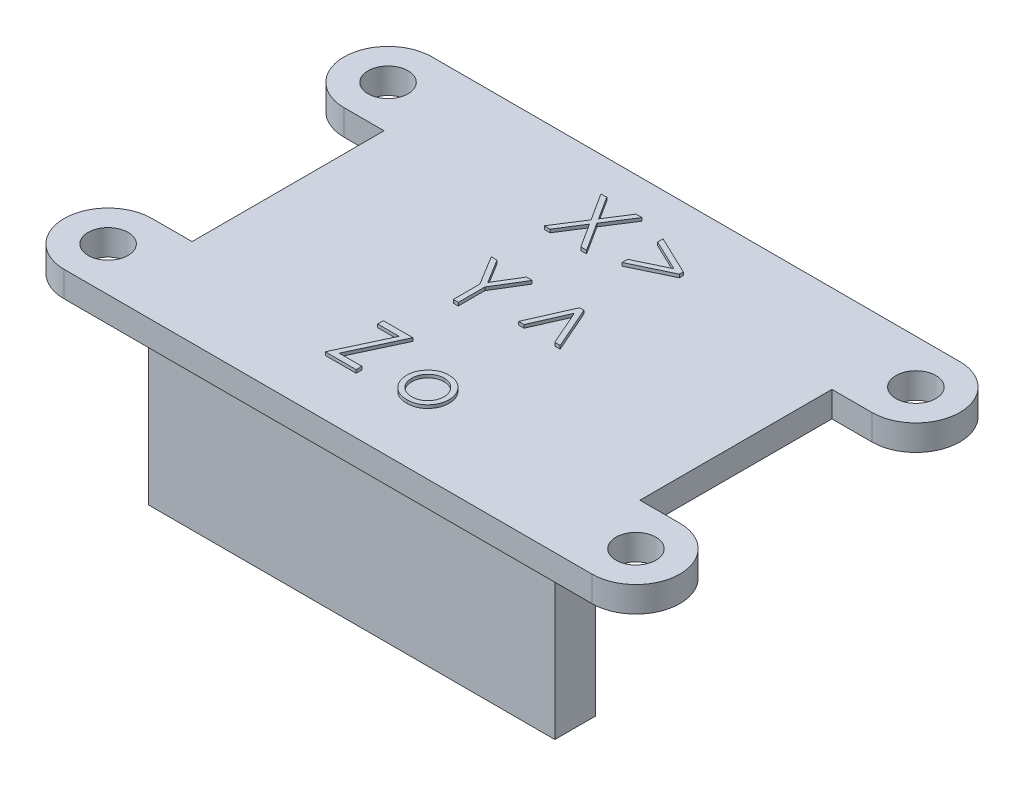
from build123d import *

# Parameters (mm, degrees)
BOSS_EXTRUDE1_DEPTH = 1.6
SKETCH2_R           = 1.25
CUT_EXTRUDE1_DEPTH  = 23.480491543
SKETCH3_W           = 25.4
SKETCH3_H           = 2.54
BOSS_EXTRUDE2_DEPTH = 10
BOSS_EXTRUDE3_DEPTH = 0.2


with BuildPart() as part:
    # Sketch1 → Boss-Extrude1 (new body)
    with BuildSketch(Plane(origin=(0, 0, 0), x_dir=(1, 0, 0), z_dir=(0, 1, 0))):
        with BuildLine():
            Line((-14, 11.5), (-16.5, 11.5))
            ThreePointArc((-16.5, 11.5), (-19.25, 8.75), (-16.5, 6))
            Line((-16.5, 6), (-14, 6))
            Line((-14, 6), (-14, -6))
            Line((-14, -6), (-16.5, -6))
            ThreePointArc((-16.5, -6), (-19.25, -8.75), (-16.5, -11.5))
            Line((-16.5, -11.5), (-14, -11.5))
            Line((-14, -11.5), (14, -11.5))
            Line((14, -11.5), (16.5, -11.5))
            ThreePointArc((16.5, -11.5), (19.25, -8.75), (16.5, -6))
            Line((16.5, -6), (14, -6))
            Line((14, -6), (14, 6))
            Line((14, 6), (16.5, 6))
            ThreePointArc((16.5, 6), (19.25, 8.75), (16.5, 11.5))
            Line((16.5, 11.5), (14, 11.5))
            Line((14, 11.5), (-14, 11.5))
        make_face()
    extrude(amount=BOSS_EXTRUDE1_DEPTH)

    # Sketch2 → Cut-Extrude1 (cut, through all)
    with BuildSketch(Plane(origin=(0, 1.6, 0), x_dir=(1, 0, 0), z_dir=(0, 1, 0))):
        with Locations(Location((-16.5, 8.75, 0), (0, 0, 270))):
            Circle(SKETCH2_R)
        with Locations(Location((16.5, 8.75, 0), (0, 0, 270))):
            Circle(SKETCH2_R)
        with Locations(Location((16.5, -8.75, 0), (0, 0, 270))):
            Circle(SKETCH2_R)
        with Locations(Location((-16.5, -8.75, 0), (0, 0, 270))):
            Circle(SKETCH2_R)
    extrude(amount=-CUT_EXTRUDE1_DEPTH, mode=Mode.SUBTRACT)

    # Sketch3 → Boss-Extrude2 (add)
    with BuildSketch(Plane.XZ):
        with Locations((0, 8.75)):
            Rectangle(SKETCH3_W, SKETCH3_H)
    extrude(amount=BOSS_EXTRUDE2_DEPTH)

    # Sketch4 → Boss-Extrude3 (add)
    # profile 1 of 6: a face of its own
    with BuildSketch(Plane(origin=(0, 1.6, 0), x_dir=(1, 0, 0), z_dir=(0, 1, 0))):
        Polygon((-3.603530873, 9.165262271), (-3.241050905, 9.165262271), (-2.324684719, 7.733571566), (-1.408318533, 9.165262271), (-1.045838565, 9.165262271), (-2.143094174, 7.450318361), (-1.00096677, 5.665262271), (-1.363446738, 5.665262271), (-2.324684719, 7.167065156), (-3.2859227, 5.665262271), (-3.648402668, 5.665262271), (-2.505574142, 7.450318361), align=None)
    # profile 2 of 6: a face of its own
    with BuildSketch(Plane(origin=(0, 1.6, 0), x_dir=(1, 0, 0), z_dir=(0, 1, 0))):
        Polygon((0.771469127, 6.455426534), (2.736012396, 7.392826374), (0.771469127, 8.330226214), (0.771469127, 8.671672528), (3.19454605, 7.515522688), (3.19454605, 7.27013006), (0.771469127, 6.11398022), align=None)
    # profile 3 of 6: a face of its own
    with BuildSketch(Plane(origin=(0, 1.6, 0), x_dir=(1, 0, 0), z_dir=(0, 1, 0))):
        Polygon((-3.62596677, 2.331928938), (-3.26629129, 2.331928938), (-2.346419495, 0.828022688), (-1.427949944, 2.331928938), (-1.068274463, 2.331928938), (-2.190069335, 0.495690957), (-2.190069335, -1.168071062), (-2.504171899, -1.168071062), (-2.504171899, 0.495690957), align=None)
    # profile 4 of 6: a face of its own
    with BuildSketch(Plane(origin=(0, 1.6, 0), x_dir=(1, 0, 0), z_dir=(0, 1, 0))):
        Polygon((1.893263999, 2.331928938), (2.162494768, 2.331928938), (3.329161435, -0.315506959), (2.990519608, -0.315506959), (2.027879383, 1.868487432), (1.065239159, -0.315506959), (0.726597332, -0.315506959), align=None)
    # profile 5 of 6: a face of its own
    with BuildSketch(Plane(origin=(0, 1.6, 0), x_dir=(1, 0, 0), z_dir=(0, 1, 0))):
        Polygon((-3.536223181, -4.860378754), (-3.536223181, -4.501404395), (-1.696479591, -4.501404395), (-3.164628629, -7.642430036), (-1.741351386, -7.642430036), (-1.741351386, -8.001404395), (-3.670838565, -8.001404395), (-2.202689527, -4.860378754), align=None)
    # profile 6 of 6: a face of its own
    with BuildSketch(Plane(origin=(0, 1.6, 0), x_dir=(1, 0, 0), z_dir=(0, 1, 0))):
        with BuildLine():
            add(Edge.make_bspline(
                [(1.468384191, -5.398840293), (1.516375464, -5.399862184), (1.610474622, -5.401865863), (1.748282507, -5.423280828), (1.879827643, -5.456028193), (2.005613835, -5.501299755), (2.124030131, -5.561981705), (2.236801375, -5.634390996), (2.343618384, -5.72017359), (2.407641413, -5.786531658), (2.440138999, -5.820214492)],
                knots=[0, 0, 0, 0, 1.054011418, 2.066658804, 3.057071809, 4.030435133, 4.997543892, 5.974964718, 6.972108034, 8, 8, 8, 8], degree=3))
            add(Edge.make_bspline(
                [(2.440138999, -5.820214492), (2.468120953, -5.852428477), (2.523543333, -5.91623302), (2.594609052, -6.019688632), (2.655830612, -6.126828733), (2.704893573, -6.23907606), (2.743578597, -6.355450731), (2.771044293, -6.476352742), (2.787381228, -6.601515089), (2.789584195, -6.686518927), (2.790699896, -6.729569459)],
                knots=[0, 0, 0, 0, 1.025258237, 2.030674902, 3.01204498, 3.988269485, 4.97094183, 5.956517959, 6.965070386, 8, 8, 8, 8], degree=3))
            add(Edge.make_bspline(
                [(2.790699896, -6.729569459), (2.789718559, -6.772869517), (2.787779391, -6.85843245), (2.769435774, -6.984451816), (2.740904688, -7.106646639), (2.70007285, -7.224505333), (2.647714741, -7.33838816), (2.583824053, -7.447797709), (2.507952436, -7.552949843), (2.421948439, -7.652951681), (2.326896563, -7.745117896), (2.223780415, -7.825446165), (2.114626381, -7.89426769), (1.997983028, -7.949704105), (1.874915541, -7.993413806), (1.745158473, -8.024113822), (1.608913403, -8.042675506), (1.515886181, -8.045059079), (1.468384191, -8.04627619)],
                knots=[0, 0, 0, 0, 0.998656419, 1.973391657, 2.932242238, 3.890759089, 4.846373663, 5.82037756, 6.809684879, 7.83454468, 8.860553229, 9.859544525, 10.845671541, 11.83227036, 12.833544569, 13.85385346, 14.904124723, 16, 16, 16, 16], degree=3))
            add(Edge.make_bspline(
                [(1.468384191, -8.04627619), (1.420649472, -8.045054994), (1.327158612, -8.04266322), (1.19043263, -8.024185937), (1.060443011, -7.993427954), (0.937214412, -7.949560461), (0.820069566, -7.894265918), (0.710283069, -7.825654228), (0.607083153, -7.745094073), (0.512011169, -7.652958136), (0.426012563, -7.55294818), (0.350139555, -7.447798141), (0.286249229, -7.338388048), (0.233891025, -7.224505363), (0.193059212, -7.106646631), (0.164528119, -6.984451818), (0.146184505, -6.85843245), (0.144245336, -6.772869517), (0.143263999, -6.729569459)],
                knots=[0, 0, 0, 0, 1.099876186, 2.154163076, 3.173186993, 4.173200201, 5.163417411, 6.152872554, 7.150605724, 8.17532212, 9.198891216, 10.186952605, 11.159729845, 12.11414092, 13.071450619, 14.029093627, 15.002601286, 16, 16, 16, 16], degree=3))
            add(Edge.make_bspline(
                [(0.143263999, -6.729569459), (0.144387309, -6.686752914), (0.146611271, -6.601983511), (0.16293178, -6.477056451), (0.190290336, -6.356359061), (0.229021733, -6.240433585), (0.278536924, -6.128678149), (0.338898211, -6.021273318), (0.410688844, -5.918285518), (0.465890796, -5.854563438), (0.493824896, -5.822317857)],
                knots=[0, 0, 0, 0, 1.031353054, 2.041901799, 3.029428768, 4.008703097, 4.981709435, 5.96992636, 6.972712378, 8, 8, 8, 8], degree=3))
            add(Edge.make_bspline(
                [(0.493824896, -5.822317857), (0.526273487, -5.788342918), (0.590089351, -5.721525221), (0.697438079, -5.635992697), (0.8099319, -5.562076623), (0.929656826, -5.502600408), (1.055339684, -5.45576189), (1.187558927, -5.423196375), (1.325834442, -5.40194302), (1.420394063, -5.399884842), (1.468384191, -5.398840293)],
                knots=[0, 0, 0, 0, 1.027980169, 2.021703884, 2.998553061, 3.971491411, 4.943284454, 5.930300938, 6.949603206, 8, 8, 8, 8], degree=3))
        make_face()
        with BuildLine():
            add(Edge.make_bspline(
                [(1.466981948, -5.712942857), (1.433044336, -5.713907449), (1.366045208, -5.715811731), (1.267425623, -5.730295636), (1.172485469, -5.75324314), (1.081044625, -5.785847196), (0.993411452, -5.827946095), (0.90950205, -5.879654455), (0.82906961, -5.940287412), (0.753687547, -6.009750083), (0.684505235, -6.085629078), (0.624027258, -6.166477437), (0.572602152, -6.250983783), (0.529761993, -6.339235994), (0.497854805, -6.432128408), (0.474681782, -6.528609039), (0.460211542, -6.628874456), (0.458325163, -6.697035474), (0.457366563, -6.731672825)],
                knots=[0, 0, 0, 0, 1.021534396, 2.016698045, 2.994645724, 3.958388632, 4.93408049, 5.916473867, 6.921342795, 7.962252576, 8.998418191, 10.008913653, 10.997312074, 11.973003931, 12.956656626, 13.948281152, 14.957379055, 16, 16, 16, 16], degree=3))
            add(Edge.make_bspline(
                [(0.457366563, -6.731672825), (0.458973387, -6.776424852), (0.462162631, -6.865249258), (0.488097867, -6.99606038), (0.531484147, -7.121642232), (0.590071427, -7.241258618), (0.663477646, -7.351930896), (0.749964712, -7.450602381), (0.848604413, -7.535788192), (0.958220913, -7.606469038), (1.076575231, -7.662628793), (1.201831552, -7.702427769), (1.332472246, -7.728299462), (1.421752977, -7.730870936), (1.466981948, -7.732173626)],
                knots=[0, 0, 0, 0, 1.016792936, 2.018143844, 3.017858371, 4.030088057, 5.03801393, 6.028138512, 7.003788237, 7.991172063, 8.984598303, 9.972568034, 10.972917682, 12, 12, 12, 12], degree=3))
            add(Edge.make_bspline(
                [(1.466981948, -7.732173626), (1.512208316, -7.730863346), (1.601483912, -7.728276889), (1.731943089, -7.702558069), (1.856857061, -7.662454409), (1.975088449, -7.606532199), (2.084655052, -7.535519784), (2.184004173, -7.451083407), (2.269752785, -7.351669556), (2.343086389, -7.241112027), (2.402633132, -7.121827675), (2.445816334, -6.996037202), (2.47181392, -6.86525516), (2.474994749, -6.77642683), (2.476597332, -6.731672825)],
                knots=[0, 0, 0, 0, 1.02726834, 2.027799167, 3.010890988, 4.004497153, 4.992059811, 5.971914811, 6.958719428, 7.966827853, 8.981595046, 9.981490638, 10.983022906, 12, 12, 12, 12], degree=3))
            add(Edge.make_bspline(
                [(2.476597332, -6.731672825), (2.475639062, -6.697035267), (2.473753333, -6.628873841), (2.459278369, -6.528611388), (2.436122829, -6.432119791), (2.404151212, -6.339267788), (2.361497198, -6.250755284), (2.309080405, -6.166725557), (2.248849379, -6.085349011), (2.178832258, -6.00999537), (2.103528881, -5.940260333), (2.023063842, -5.879630944), (1.939278864, -5.828173348), (1.851900281, -5.785487108), (1.760447714, -5.753539767), (1.665640584, -5.730163136), (1.567441774, -5.715872939), (1.500682731, -5.713925798), (1.466981948, -5.712942857)],
                knots=[0, 0, 0, 0, 1.042956736, 2.052379634, 3.044323526, 4.02829302, 5.004299113, 5.996692471, 7.007513377, 8.048758398, 9.090003419, 10.095195979, 11.07790575, 12.047570684, 13.018257071, 13.989683339, 14.985167495, 16, 16, 16, 16], degree=3))
        make_face(mode=Mode.SUBTRACT)
    extrude(amount=BOSS_EXTRUDE3_DEPTH)


solid = part.part
